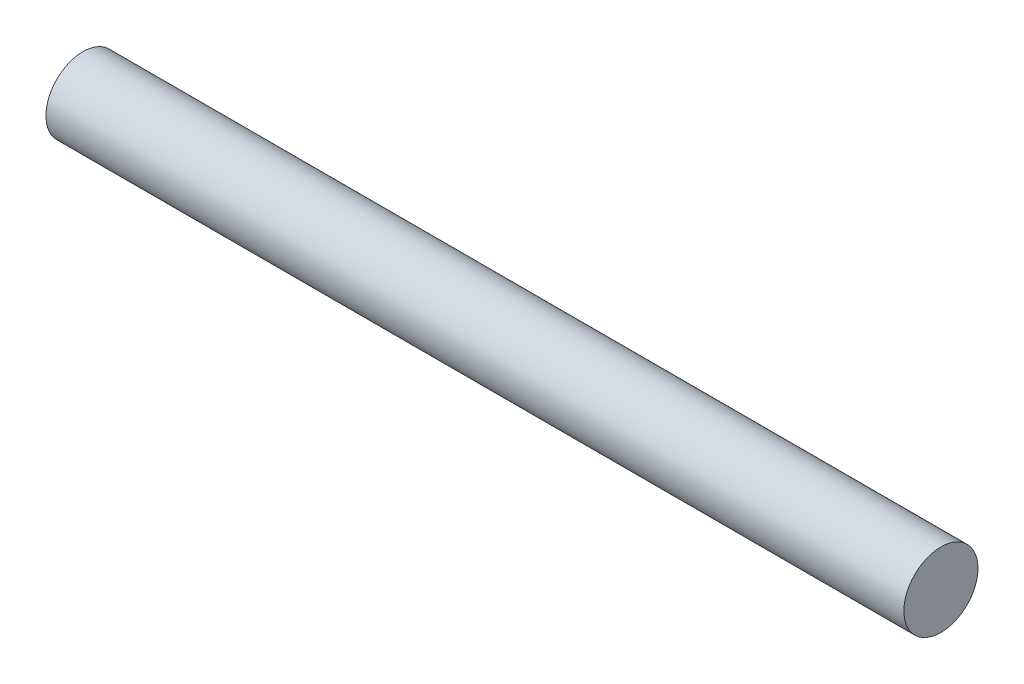
from build123d import *

# Parameters (mm, degrees)
SKETCH1_R           = 3
BOSS_EXTRUDE1_DEPTH = 69.420000098


with BuildPart() as part:
    # Sketch1 → Boss-Extrude1 (new body)
    with BuildSketch(Plane(origin=(0, 0, 0), x_dir=(0, 0, -1), z_dir=(1, 0, 0))):
        Circle(SKETCH1_R)
    extrude(amount=BOSS_EXTRUDE1_DEPTH)


solid = part.part
